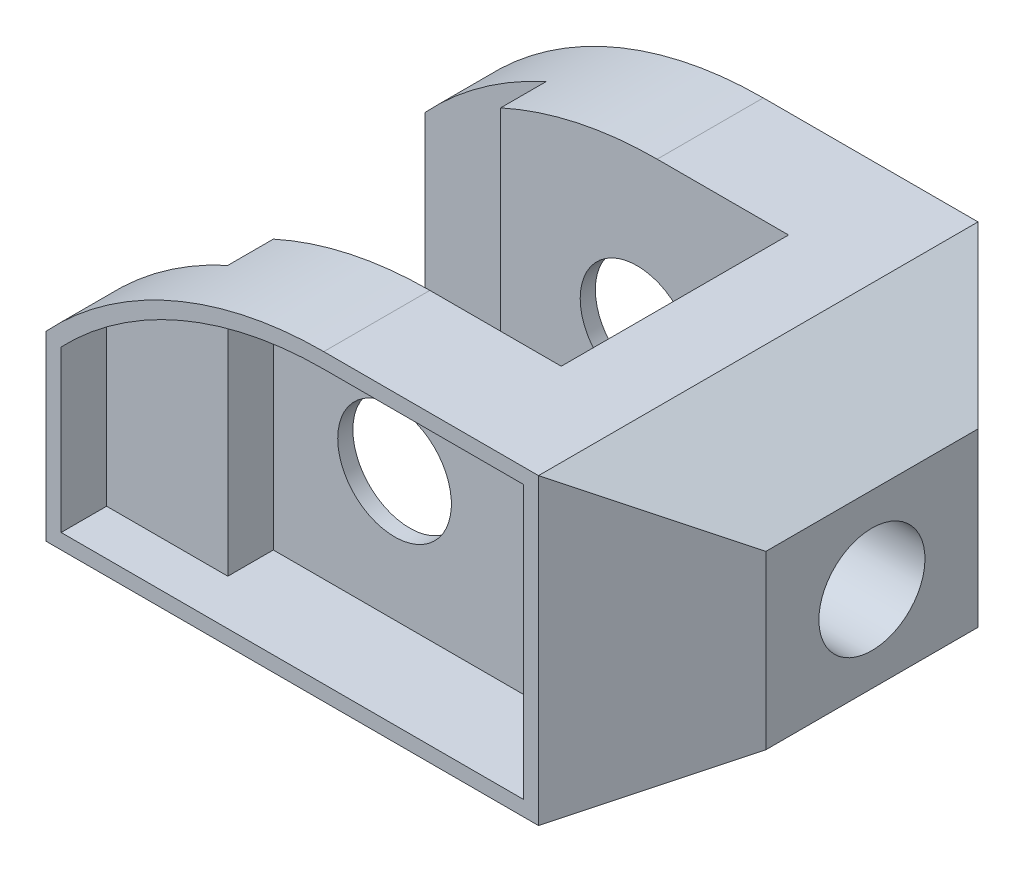
from build123d import *

# Parameters (mm, degrees)
SKETCH1_R           = 7.5
BOSS_EXTRUDE1_DEPTH = 58
SKETCH2_W           = 38
SKETCH2_H           = 30
CUT_EXTRUDE1_DEPTH  = 85.142735872
SKETCH4_W           = 16
SKETCH4_H           = 6
CUT_EXTRUDE3_DEPTH  = 85.142735872
SKETCH5_R           = 7
CUT_EXTRUDE4_DEPTH  = 102.019800039
CUT_EXTRUDE5_DEPTH  = 85.142735872
CUT_EXTRUDE7_DEPTH  = 12
CUT_EXTRUDE8_DEPTH  = 6
CUT_EXTRUDE9_DEPTH  = 12
CUT_EXTRUDE10_DEPTH = 6


with BuildPart() as part:
    # Sketch1 → Boss-Extrude1 (new body)
    with BuildSketch(Plane.XY):
        with BuildLine():
            Line((-34, -19), (31, -19))
            Line((31, -19), (46, -10.339745962))
            Line((46, -10.339745962), (46, 12.339745962))
            Line((46, 12.339745962), (31, 21))
            Line((31, 21), (2.66060556, 21))
            ThreePointArc((2.66060556, 21), (-17.33939444, 16.82575695), (-34, 5))
            Line((-34, 5), (-34, -19))
        make_face()
        Circle(SKETCH1_R, mode=Mode.SUBTRACT)
    extrude(amount=BOSS_EXTRUDE1_DEPTH)

    # Sketch2 → Cut-Extrude1 (cut, through all)
    with BuildSketch(Plane(origin=(0, 21, 0), x_dir=(1, 0, 0), z_dir=(0, 1, 0))):
        with Locations((1, -29)):
            Rectangle(SKETCH2_W, SKETCH2_H)
    extrude(amount=-CUT_EXTRUDE1_DEPTH, mode=Mode.SUBTRACT)

    # Sketch4 → Cut-Extrude3 (cut, through all)
    with BuildSketch(Plane(origin=(0, 21, 0), x_dir=(1, 0, 0), z_dir=(0, 1, 0))):
        with Locations((-26, -11)):
            Rectangle(SKETCH4_W, SKETCH4_H)
        with Locations((-26, -47)):
            Rectangle(SKETCH4_W, SKETCH4_H)
    extrude(amount=-CUT_EXTRUDE3_DEPTH, mode=Mode.SUBTRACT)


with BuildPart() as body_2:
    # of the pieces the cut leaves, the one that is kept (cut_extrude3_keep)
    add(part.part.solids().sort_by_distance((2.66060556, 21, 0))[0])

    # Sketch5 → Cut-Extrude4 (cut, through all)
    with BuildSketch(Plane(origin=(46, 0, 0), x_dir=(0, 0, -1), z_dir=(1, 0, 0))):
        with Locations((-29, 1)):
            Circle(SKETCH5_R)
    extrude(amount=-CUT_EXTRUDE4_DEPTH, mode=Mode.SUBTRACT)

    # Sketch6 → Cut-Extrude5 (cut, through all)
    with BuildSketch(Plane(origin=(0, 21, 0), x_dir=(1, 0, 0), z_dir=(0, 1, 0))):
        Polygon((31, 0), (46, -15), (46, 0), align=None)
        Polygon((46, -43), (31, -58), (46, -58), align=None)
    extrude(amount=-CUT_EXTRUDE5_DEPTH, mode=Mode.SUBTRACT)

    # Sketch7 → Cut-Extrude7 (cut)
    with BuildSketch(Plane.XY.offset(58)):
        with BuildLine():
            Line((-16, 15.224221872), (-16, -17))
            Line((-16, -17), (29, -17))
            Line((29, -17), (29, 19))
            Line((29, 19), (2.66060556, 19))
            ThreePointArc((2.66060556, 19), (-6.858778616, 18.046586751), (-16, 15.224221872))
        make_face()
    extrude(amount=-CUT_EXTRUDE7_DEPTH, mode=Mode.SUBTRACT)

    # Sketch8 → Cut-Extrude8 (cut)
    with BuildSketch(Plane.XY.offset(58)):
        with BuildLine():
            Line((-16, 15.224221872), (-16, -17))
            Line((-16, -17), (-32, -17))
            Line((-32, -17), (-32, 4.206060023))
            ThreePointArc((-32, 4.206060023), (-24.563241733, 10.533051217), (-16, 15.224221872))
        make_face()
    extrude(amount=-CUT_EXTRUDE8_DEPTH, mode=Mode.SUBTRACT)

    # Sketch9 → Cut-Extrude9 (cut)
    with BuildSketch(Plane(origin=(0, 0, 0), x_dir=(-1, 0, 0), z_dir=(0, 0, -1))):
        with BuildLine():
            Line((16, 15.224221872), (16, -17))
            Line((16, -17), (-29, -17))
            Line((-29, -17), (-29, 19))
            Line((-29, 19), (-2.66060556, 19))
            ThreePointArc((-2.66060556, 19), (6.858778616, 18.046586751), (16, 15.224221872))
        make_face()
    extrude(amount=-CUT_EXTRUDE9_DEPTH, mode=Mode.SUBTRACT)

    # Sketch10 → Cut-Extrude10 (cut)
    with BuildSketch(Plane(origin=(0, 0, 0), x_dir=(-1, 0, 0), z_dir=(0, 0, -1))):
        with BuildLine():
            Line((16, 15.224221872), (16, -17))
            Line((16, -17), (32, -17))
            Line((32, -17), (32, 4.206060023))
            ThreePointArc((32, 4.206060023), (24.563241733, 10.533051217), (16, 15.224221872))
        make_face()
    extrude(amount=-CUT_EXTRUDE10_DEPTH, mode=Mode.SUBTRACT)


solid = body_2.part
